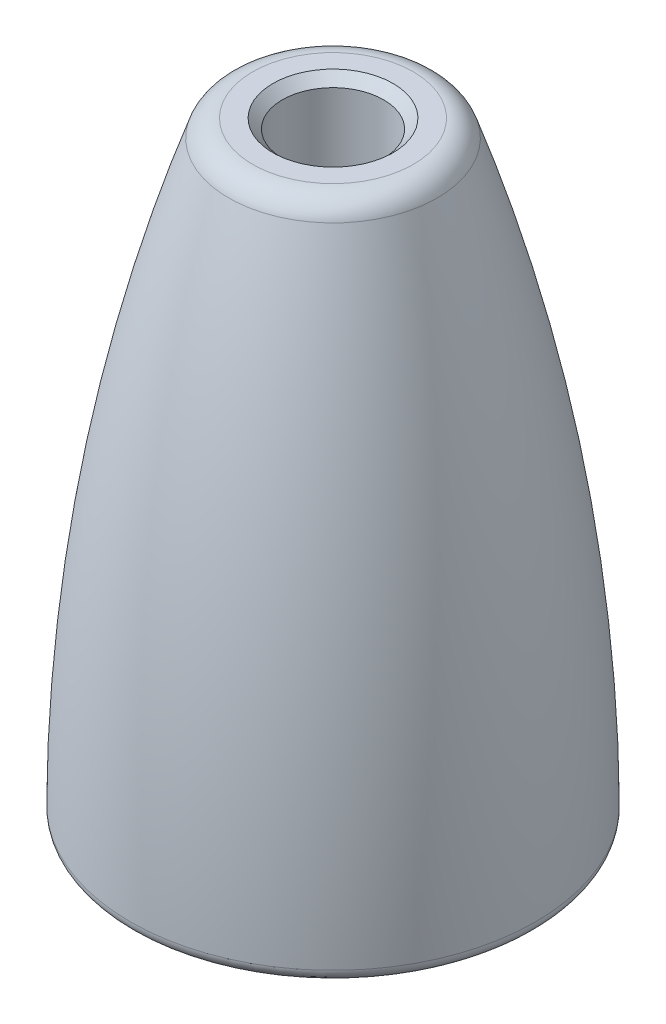
from build123d import *

# Parameters (mm, degrees)
SCALE1_SCALE = 0.8


with BuildPart() as part:
    # Sketch1 → Revolve1 (revolve)
    with BuildSketch(Plane(origin=(0, 0, 0), x_dir=(0, 0, -1), z_dir=(1, 0, 0))):
        with BuildLine():
            Line((1.5875, 0.295348837), (1.5875, 18.754651163))
            Line((1.5875, 18.754651163), (1.882848837, 19.05))
            Line((1.882848837, 19.05), (2.517316605, 19.05))
            ThreePointArc((2.517316605, 19.05), (2.978804363, 18.902058108), (3.268264727, 18.513380282))
            ThreePointArc((3.268264727, 18.513380282), (5.541145691, 9.581116964), (6.348602604, 0.39965035))
            ThreePointArc((6.348602604, 0.39965035), (6.233349837, 0.117224952), (5.951737308, 0))
            Line((5.951737308, 0), (1.882848837, 0))
            Line((1.882848837, 0), (1.5875, 0.295348837))
        make_face()
    revolve(axis=Axis((0, 0, 0), (0, 1, 0)))


with BuildPart() as part_1:
    # Scale1: scaled about (0, 7.536075139, 0)
    add(part.part.scale(SCALE1_SCALE).moved(Location((0, 1.507215028, 0))))


solid = part_1.part
